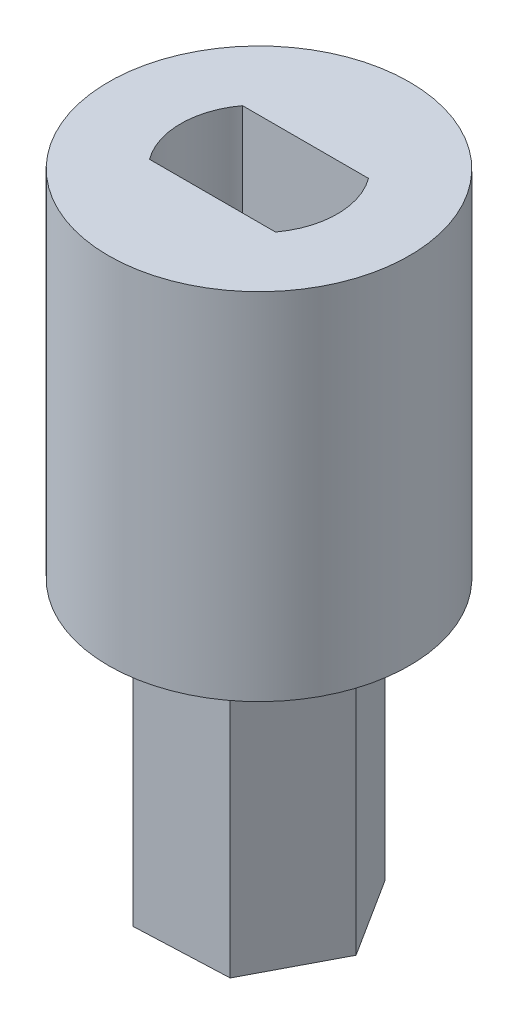
from build123d import *

# Parameters (mm, degrees)
SALIENTE_EXTRUIR1_DEPTH = 11.5
CROQUIS2_R              = 6.15
SALIENTE_EXTRUIR2_DEPTH = 14.51
CROQUIS3_R              = 1.25
CORTAR_EXTRUIR1_DEPTH   = 8
CORTAR_EXTRUIR2_DEPTH   = 8


with BuildPart() as part:
    # Croquis1 → Saliente-Extruir1 (new body)
    with BuildSketch(Plane(origin=(0, 0, 0), x_dir=(1, 0, 0), z_dir=(0, 1, 0))):
        Polygon((2.041290993, -3.217628176), (3.807193237, 0.158995769), (1.765902244, 3.376623945), (-2.041290993, 3.217628176), (-3.807193237, -0.158995769), (-1.765902244, -3.376623945), align=None)
    extrude(amount=SALIENTE_EXTRUIR1_DEPTH)

    # Croquis2 → Saliente-Extruir2 (add)
    with BuildSketch(Plane(origin=(0, 11.5, 0), x_dir=(1, 0, 0), z_dir=(0, 1, 0))):
        with Locations(Location((0, 0, 0), (0, 0, 270))):
            Circle(CROQUIS2_R)
    extrude(amount=SALIENTE_EXTRUIR2_DEPTH)

    # Croquis3 → Cortar-Extruir1 (cut)
    with BuildSketch(Plane.XZ):
        with Locations(Location((0, 0, 0), (0, 0, 270))):
            Circle(CROQUIS3_R)
    extrude(amount=-CORTAR_EXTRUIR1_DEPTH, mode=Mode.SUBTRACT)

    # Croquis4 → Cortar-Extruir2 (cut)
    with BuildSketch(Plane(origin=(0, 26.01, 0), x_dir=(1, 0, 0), z_dir=(0, 1, 0))):
        with BuildLine():
            Line((-2.574878638, 1.9), (2.574878638, 1.9))
            ThreePointArc((2.574878638, 1.9), (3.2, 0), (2.574878638, -1.9))
            Line((2.574878638, -1.9), (-2.574878638, -1.9))
            ThreePointArc((-2.574878638, -1.9), (-3.2, 0), (-2.574878638, 1.9))
        make_face()
    extrude(amount=-CORTAR_EXTRUIR2_DEPTH, mode=Mode.SUBTRACT)


solid = part.part
